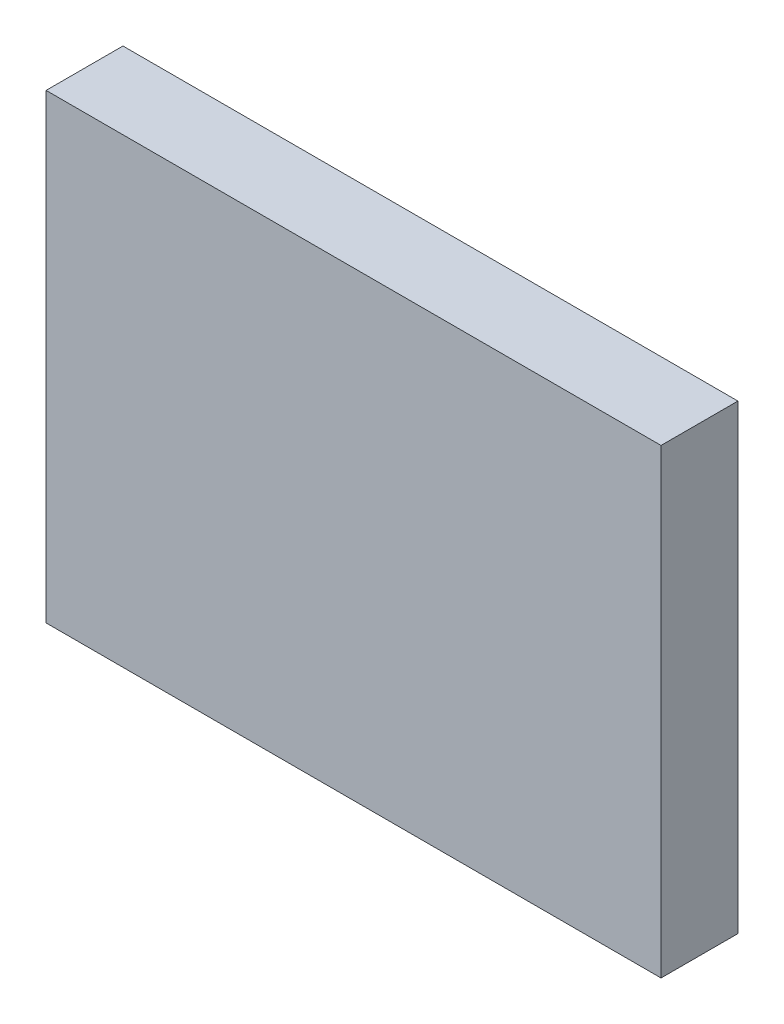
from build123d import *

# Parameters (mm, degrees)
ESQUISSE1_W        = 101.6
ESQUISSE1_H        = 76.2
BOSS_EXTRU_1_DEPTH = 12.7


with BuildPart() as part:
    # Esquisse1 → Boss.-Extru.1 (new body)
    with BuildSketch(Plane.XY):
        Rectangle(ESQUISSE1_W, ESQUISSE1_H)
    extrude(amount=BOSS_EXTRU_1_DEPTH)


solid = part.part
